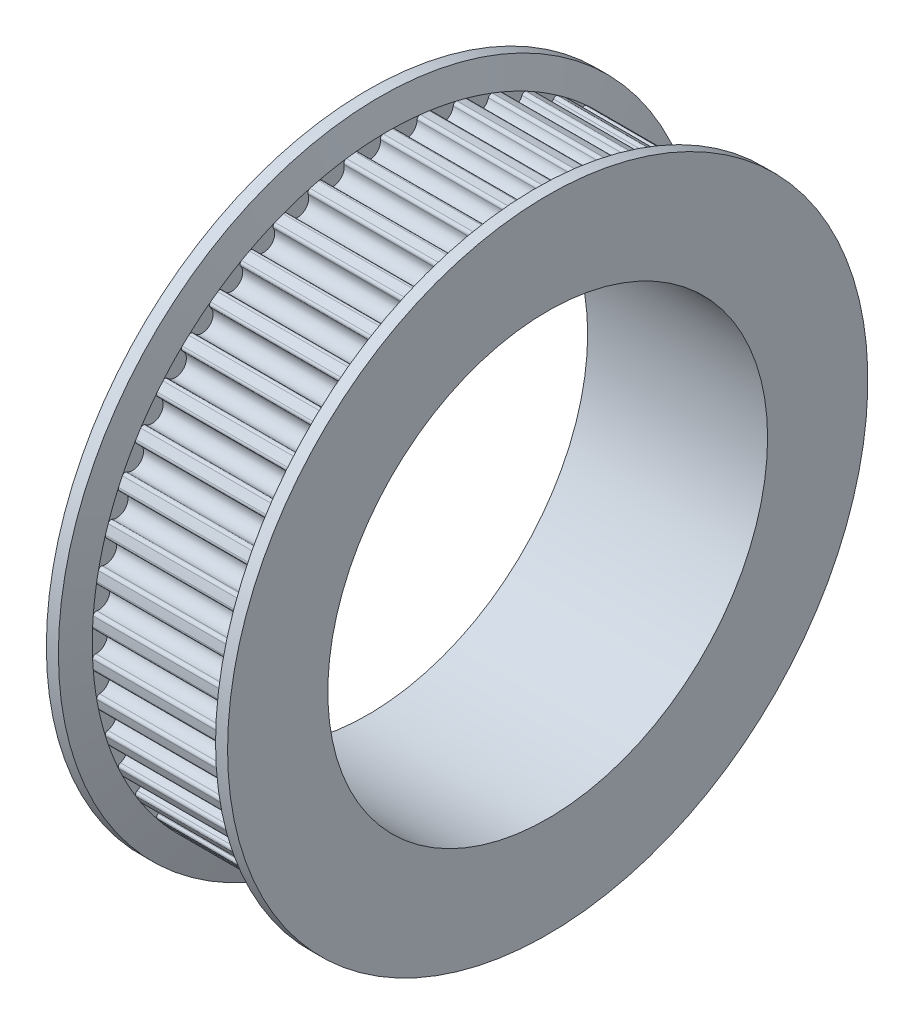
from build123d import *

# Parameters (mm, degrees)
F_20TOOTH_START     = -1
TOOTH_R             = 0.55
F_20TOOTH_DEPTH     = 7
CHFR_R              = 0.15
SKETCH1_R           = 12.562936203
SKETCH1_R_2         = 11
BOSS_EXTRUDE1_DEPTH = 9


with BuildPart() as part:
    # bod → Body (revolve)
    with BuildSketch(Plane.XY, mode=Mode.PRIVATE) as body_sk:
        Polygon((6.041209047, 12.521727156), (14.958790953, 12.521727156), (15, 12.562936203), (15, 16.014212221), (14.398179889, 16.014212221), (14, 14.78), (7, 14.78), (6.601820111, 16.079563948), (6, 16.079563948), (6, 12.562936203), align=None)
    revolve(body_sk.sketch.rotate(Axis((6, 0, 0), (1, 0, 0)), 90), axis=Axis((6, 0, 0), (1, 0, 0)))

    # tooth → 20tooth (cut)
    with BuildSketch(Plane.ZY.offset(-6).offset(F_20TOOTH_START)):
        with Locations((14.457356915, -1.826388913)):
            Circle(TOOTH_R)
        with Locations((-11.789208871, -8.565361616)):
            Circle(TOOTH_R)
        with Locations((14.114449109, -3.623974582)):
            Circle(TOOTH_R)
        with Locations((13.548948009, -5.364408007)):
            Circle(TOOTH_R)
        with Locations((12.769771906, -7.020241513)):
            Circle(TOOTH_R)
        with Locations((11.789208871, -8.565361616)):
            Circle(TOOTH_R)
        with Locations((14.572263566, 0)):
            Circle(TOOTH_R)
        with Locations((10.62272297, -9.975400851)):
            Circle(TOOTH_R)
        with Locations((9.288710382, -11.228122054)):
            Circle(TOOTH_R)
        with Locations((7.808209282, -12.303769066)):
            Circle(TOOTH_R)
        with Locations((6.204568057, -13.18537829)):
            Circle(TOOTH_R)
        with Locations((4.503077088, -13.859046221)):
            Circle(TOOTH_R)
        with Locations((2.730569903, -14.314148715)):
            Circle(TOOTH_R)
        with Locations((0.915, -14.543508532)):
            Circle(TOOTH_R)
        with Locations((-0.915, -14.543508532)):
            Circle(TOOTH_R)
        with Locations((-12.769771906, -7.020241513)):
            Circle(TOOTH_R)
        with Locations((-13.548948009, -5.364408007)):
            Circle(TOOTH_R)
        with Locations((-2.730569903, -14.314148715)):
            Circle(TOOTH_R)
        with Locations((-4.503077088, -13.859046221)):
            Circle(TOOTH_R)
        with Locations((-6.204568057, -13.18537829)):
            Circle(TOOTH_R)
        with Locations((-7.808209282, -12.303769066)):
            Circle(TOOTH_R)
        with Locations((-9.288710382, -11.228122054)):
            Circle(TOOTH_R)
        with Locations((-10.62272297, -9.975400851)):
            Circle(TOOTH_R)
        with Locations((-14.114449109, -3.623974582)):
            Circle(TOOTH_R)
        with Locations((-14.457356915, -1.826388913)):
            Circle(TOOTH_R)
        with Locations((-14.572263566, 0)):
            Circle(TOOTH_R)
        with Locations((-14.457356915, 1.826388913)):
            Circle(TOOTH_R)
        with Locations((-14.114449109, 3.623974582)):
            Circle(TOOTH_R)
        with Locations((-13.548948009, 5.364408007)):
            Circle(TOOTH_R)
        with Locations((-12.769771906, 7.020241513)):
            Circle(TOOTH_R)
        with Locations((-11.789208871, 8.565361616)):
            Circle(TOOTH_R)
        with Locations((-10.62272297, 9.975400851)):
            Circle(TOOTH_R)
        with Locations((-9.288710382, 11.228122054)):
            Circle(TOOTH_R)
        with Locations((-7.808209282, 12.303769066)):
            Circle(TOOTH_R)
        with Locations((-6.204568057, 13.18537829)):
            Circle(TOOTH_R)
        with Locations((-4.503077088, 13.859046221)):
            Circle(TOOTH_R)
        with Locations((-2.730569903, 14.314148715)):
            Circle(TOOTH_R)
        with Locations((-0.915, 14.543508532)):
            Circle(TOOTH_R)
        with Locations((0.915, 14.543508532)):
            Circle(TOOTH_R)
        with Locations((2.730569903, 14.314148715)):
            Circle(TOOTH_R)
        with Locations((4.503077088, 13.859046221)):
            Circle(TOOTH_R)
        with Locations((6.204568057, 13.18537829)):
            Circle(TOOTH_R)
        with Locations((7.808209282, 12.303769066)):
            Circle(TOOTH_R)
        with Locations((9.288710382, 11.228122054)):
            Circle(TOOTH_R)
        with Locations((10.62272297, 9.975400851)):
            Circle(TOOTH_R)
        with Locations((11.789208871, 8.565361616)):
            Circle(TOOTH_R)
        with Locations((12.769771906, 7.020241513)):
            Circle(TOOTH_R)
        with Locations((13.548948009, 5.364408007)):
            Circle(TOOTH_R)
        with Locations((14.114449109, 3.623974582)):
            Circle(TOOTH_R)
        with Locations((14.457356915, 1.826388913)):
            Circle(TOOTH_R)
    extrude(amount=-F_20TOOTH_DEPTH, mode=Mode.SUBTRACT)

    # chfr
    chfr_edges = [part.edges().sort_by_distance(p)[0] for p in [
        (10.5, -13.889688419, 5.052222839),
        (10.5, -14.206616054, 4.076819876),
        (10.5, -14.413375503, 3.27154499),
        (10.5, -14.605553661, 2.264111805),
        (10.5, -14.709755044, 1.439272923),
        (10.5, -14.774152961, 0.415697339),
        (10.5, -14.774152961, -0.415697339),
        (10.5, -14.709755044, -1.439272923),
        (10.5, -14.605553661, -2.264111805),
        (10.5, -14.413375503, -3.27154499),
        (10.5, -14.206616054, -4.076819876),
        (10.5, -13.889688419, -5.052222839),
        (10.5, -13.583631625, -5.825234061),
        (10.5, -13.146952652, -6.753224116),
        (10.5, -12.746425212, -7.481780826),
        (10.5, -12.196881588, -8.347723014),
        (10.5, -11.708200058, -9.020335437),
        (10.5, -11.054458416, -9.810573334),
        (10.5, -10.485329595, -10.416633971),
        (10.5, -9.73769983, -11.118705051),
        (10.5, -9.097099221, -11.648655964),
        (10.5, -8.267371902, -12.251488148),
        (10.5, -7.565402158, -12.696971694),
        (10.5, -6.666662579, -13.191057958),
        (10.5, -5.914394183, -13.545048595),
        (10.5, -4.960816006, -13.922596904),
        (10.5, -4.170112679, -14.179511989),
        (10.5, -3.1767344, -14.43456818),
        (10.5, -2.360066008, -14.590356008),
        (10.5, -1.342553795, -14.718897693),
        (10.5, -0.512799685, -14.771101397),
        (10.5, 0.512799685, -14.771101397),
        (10.5, 1.342553795, -14.718897693),
        (10.5, 2.360066008, -14.590356008),
        (10.5, 3.1767344, -14.43456818),
        (10.5, 4.170112679, -14.179511989),
        (10.5, 4.960816006, -13.922596904),
        (10.5, 5.914394183, -13.545048595),
        (10.5, 6.666662579, -13.191057958),
        (10.5, 7.565402158, -12.696971694),
        (10.5, 8.267371902, -12.251488148),
        (10.5, 9.097099221, -11.648655964),
        (10.5, -1.342553795, 14.718897693),
        (10.5, -2.360066008, 14.590356008),
        (10.5, 9.73769983, -11.118705051),
        (10.5, 10.485329595, -10.416633971),
        (10.5, 11.054458416, -9.810573334),
        (10.5, 11.708200058, -9.020335437),
        (10.5, 12.196881588, -8.347723014),
        (10.5, 12.746425212, -7.481780826),
        (10.5, 13.146952652, -6.753224116),
        (10.5, 13.583631625, -5.825234061),
        (10.5, 13.889688419, -5.052222839),
        (10.5, 14.206616054, -4.076819876),
        (10.5, 14.413375503, -3.27154499),
        (10.5, 14.605553661, -2.264111805),
        (10.5, 14.709755044, -1.439272923),
        (10.5, 14.774152961, -0.415697339),
        (10.5, 14.774152961, 0.415697339),
        (10.5, 14.709755044, 1.439272923),
        (10.5, 14.605553661, 2.264111805),
        (10.5, 14.413375503, 3.27154499),
        (10.5, 14.206616054, 4.076819876),
        (10.5, 13.889688419, 5.052222839),
        (10.5, -3.1767344, 14.43456818),
        (10.5, -4.170112679, 14.179511989),
        (10.5, 13.583631625, 5.825234061),
        (10.5, 13.146952652, 6.753224116),
        (10.5, 12.746425212, 7.481780826),
        (10.5, 12.196881588, 8.347723014),
        (10.5, 11.708200058, 9.020335437),
        (10.5, 11.054458416, 9.810573334),
        (10.5, 10.485329595, 10.416633971),
        (10.5, 9.73769983, 11.118705051),
        (10.5, 9.097099221, 11.648655964),
        (10.5, 8.267371902, 12.251488148),
        (10.5, 7.565402158, 12.696971694),
        (10.5, 6.666662579, 13.191057958),
        (10.5, 5.914394183, 13.545048595),
        (10.5, 4.960816006, 13.922596904),
        (10.5, 4.170112679, 14.179511989),
        (10.5, 3.1767344, 14.43456818),
        (10.5, 2.360066008, 14.590356008),
        (10.5, 1.342553795, 14.718897693),
        (10.5, -4.960816006, 13.922596904),
        (10.5, -5.914394183, 13.545048595),
        (10.5, -6.666662579, 13.191057958),
        (10.5, -7.565402158, 12.696971694),
        (10.5, -8.267371902, 12.251488148),
        (10.5, -9.097099221, 11.648655964),
        (10.5, 0.512799685, 14.771101397),
        (10.5, -0.512799685, 14.771101397),
        (10.5, -9.73769983, 11.118705051),
        (10.5, -10.485329595, 10.416633971),
        (10.5, -11.054458416, 9.810573334),
        (10.5, -11.708200058, 9.020335437),
        (10.5, -12.196881588, 8.347723014),
        (10.5, -12.746425212, 7.481780826),
        (10.5, -13.146952652, 6.753224116),
        (10.5, -13.583631625, 5.825234061),
    ]]
    fillet(chfr_edges, radius=CHFR_R)

    # Sketch1 → Boss-Extrude1 (add)
    with BuildSketch(Plane(origin=(15, 0, 0), x_dir=(0, 0, -1), z_dir=(1, 0, 0))):
        Circle(SKETCH1_R)
        Circle(SKETCH1_R_2, mode=Mode.SUBTRACT)
    extrude(amount=-BOSS_EXTRUDE1_DEPTH)


solid = part.part
